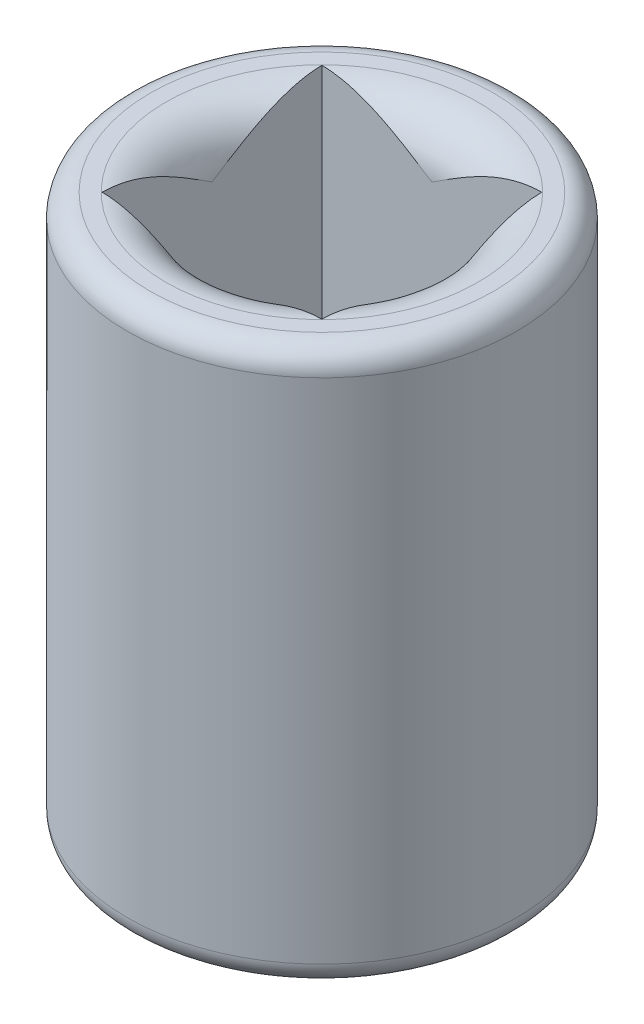
from build123d import *

# Parameters (mm, degrees)
SKETCH1_R           = 8.44
BOSS_EXTRUDE1_DEPTH = 24
SKETCH2_W           = 9.525
SKETCH2_H           = 9.525
CUT_EXTRUDE1_DEPTH  = 11.44
SKETCH3_R           = 4.5
CUT_EXTRUDE2_DEPTH  = 18.32688085
CUT_EXTRUDE3_DEPTH  = 8
FILLET1_R           = 1


with BuildPart() as part:
    # Sketch1 → Boss-Extrude1 (new body)
    with BuildSketch(Plane(origin=(0, 0, 0), x_dir=(1, 0, 0), z_dir=(0, 1, 0))):
        with Locations(Location((0, 0, 0), (0, 0, 270))):
            Circle(SKETCH1_R)
    extrude(amount=BOSS_EXTRUDE1_DEPTH)

    # Sketch2 → Cut-Extrude1 (cut)
    with BuildSketch(Plane(origin=(0, 24, 0), x_dir=(1, 0, 0), z_dir=(0, 1, 0))):
        Rectangle(SKETCH2_W, SKETCH2_H)
    extrude(amount=-CUT_EXTRUDE1_DEPTH, mode=Mode.SUBTRACT)

    # Sketch3 → Cut-Extrude2 (cut, through all)
    with BuildSketch(Plane(origin=(0, 12.56, 0), x_dir=(1, 0, 0), z_dir=(0, 1, 0))):
        with Locations(Location((0, 0, 0), (0, 0, 270))):
            Circle(SKETCH3_R)
    extrude(amount=-CUT_EXTRUDE2_DEPTH, mode=Mode.SUBTRACT)

    # Sketch4 → Cut-Extrude3 (cut)
    with BuildSketch(Plane.XZ):
        Polygon((-3.207902433, 5.55625), (-6.415804866, 0), (-3.207902433, -5.55625), (3.207902433, -5.55625), (6.415804866, 0), (3.207902433, 5.55625), align=None)
    extrude(amount=-CUT_EXTRUDE3_DEPTH, mode=Mode.SUBTRACT)

    # Sketch5 → Cut-Revolve1 (revolve, cut)
    with BuildSketch(Plane(origin=(0, 0, 0), x_dir=(0, 0, -1), z_dir=(1, 0, 0))):
        with BuildLine():
            Line((-6.55625, 0), (-5.55625, 0))
            Line((-5.55625, 0), (-5.55625, 1))
            ThreePointArc((-5.55625, 1), (-5.849143219, 0.292893219), (-6.55625, 0))
        make_face()
        with BuildLine():
            Line((-6.7625, 24), (-4.7625, 24))
            Line((-4.7625, 24), (-4.7625, 22))
            ThreePointArc((-4.7625, 22), (-5.348286438, 23.414213562), (-6.7625, 24))
        make_face()
    revolve(axis=Axis((0, 24, 0), (0, -1, 0)), mode=Mode.SUBTRACT)

    # Fillet1
    fillet1_edges = [part.edges().sort_by_distance(p)[0] for p in [
        (0, 0, -8.44),
        (0, 24, -8.44),
    ]]
    fillet(fillet1_edges, radius=FILLET1_R)


solid = part.part
